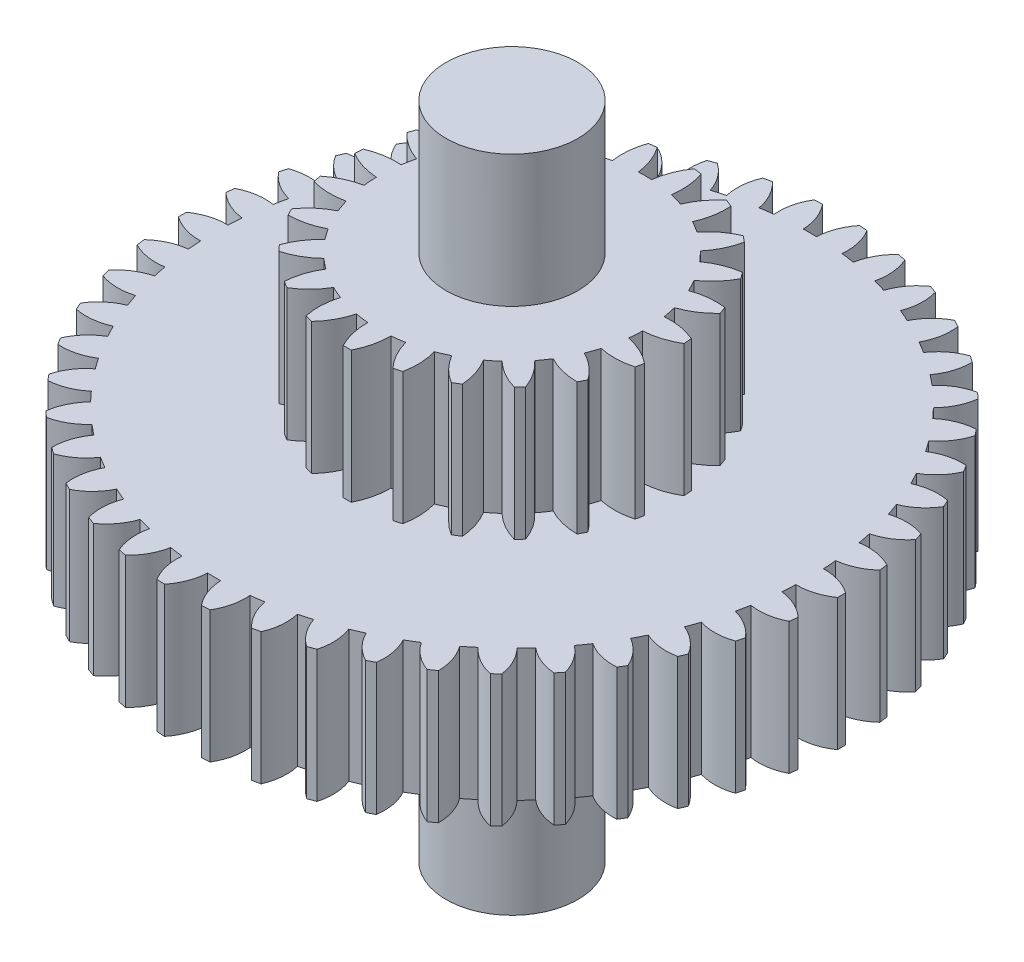
from build123d import *

# Parameters (mm, degrees)
BOSS_EXTRUDE1_DEPTH      = 1
BOSS_EXTRUDE2_DEPTH      = 2
BOSS_EXTRUDE2_DEPTH_BACK = 3
SKETCH2_R                = 0.5
BOSS_EXTRUDE3_DEPTH      = 1


with BuildPart() as part:
    # Sketch1 → Boss-Extrude1 (new body)
    with BuildSketch(Plane(origin=(0, 0, 0), x_dir=(1, 0, 0), z_dir=(0, 1, 0))):
        with BuildLine():
            ThreePointArc((-1.122849348, 2.23365381), (-1.150162594, 2.219713046), (-1.17730279, 2.20543831))
            ThreePointArc((-1.17730279, 2.20543831), (-1.174225974, 2.07727607), (-1.131251341, 1.956494417))
            ThreePointArc((-1.131251341, 1.956494417), (-1.174259727, 1.930987854), (-1.216693282, 1.904536022))
            ThreePointArc((-1.216693282, 1.904536022), (-1.3041624, 1.998259979), (-1.416540223, 2.059954804))
            ThreePointArc((-1.416540223, 2.059954804), (-1.441700805, 2.042424733), (-1.466644473, 2.024587363))
            ThreePointArc((-1.466644473, 2.024587363), (-1.446144892, 1.898037792), (-1.387124094, 1.784232818))
            ThreePointArc((-1.387124094, 1.784232818), (-1.426258754, 1.753107517), (-1.464695223, 1.721124023))
            ThreePointArc((-1.464695223, 1.721124023), (-1.564111726, 1.802064654), (-1.683843634, 1.847882739))
            ThreePointArc((-1.683843634, 1.847882739), (-1.706382858, 1.827089911), (-1.728665344, 1.806022184))
            ThreePointArc((-1.728665344, 1.806022184), (-1.691124866, 1.683442662), (-1.617157349, 1.578734337))
            ThreePointArc((-1.617157349, 1.578734337), (-1.651689279, 1.542570104), (-1.685412664, 1.505650741))
            ThreePointArc((-1.685412664, 1.505650741), (-1.79492461, 1.572300274), (-1.919780224, 1.601388114))
            ThreePointArc((-1.919780224, 1.601388114), (-1.939278227, 1.577719861), (-1.958484451, 1.553814228))
            ThreePointArc((-1.958484451, 1.553814228), (-1.904602384, 1.43748818), (-1.817066023, 1.343827023))
            ThreePointArc((-1.817066023, 1.343827023), (-1.846351958, 1.303297528), (-1.874734055, 1.262130034))
            ThreePointArc((-1.874734055, 1.262130034), (-1.992301445, 1.313246914), (-2.119954941, 1.325062658))
            ThreePointArc((-2.119954941, 1.325062658), (-2.136048511, 1.298959875), (-2.151820698, 1.272661654))
            ThreePointArc((-2.151820698, 1.272661654), (-2.082600763, 1.164756013), (-1.983126195, 1.083886754))
            ThreePointArc((-1.983126195, 1.083886754), (-2.006620594, 1.039746985), (-2.029132698, 0.995098232))
            ThreePointArc((-2.029132698, 0.995098232), (-2.152565474, 1.02973025), (-2.280638908, 1.024053793))
            ThreePointArc((-2.280638908, 1.024053793), (-2.293028254, 0.996002725), (-2.305072596, 0.967801801))
            ThreePointArc((-2.305072596, 0.967801801), (-2.22180423, 0.870326645), (-2.112244478, 0.803755726))
            ThreePointArc((-2.112244478, 0.803755726), (-2.129509684, 0.756827924), (-2.145732439, 0.709529634))
            ThreePointArc((-2.145732439, 0.709529634), (-2.272731281, 0.727031659), (-2.398838888, 0.703968742))
            ThreePointArc((-2.398838888, 0.703968742), (-2.407293218, 0.674491928), (-2.415385354, 0.644913631))
            ThreePointArc((-2.415385354, 0.644913631), (-2.319619689, 0.559684739), (-2.202015642, 0.508652249))
            ThreePointArc((-2.202015642, 0.508652249), (-2.212730038, 0.459810589), (-2.222361244, 0.41074384))
            ThreePointArc((-2.222361244, 0.41074384), (-2.350560404, 0.410789844), (-2.472353038, 0.370770087))
            ThreePointArc((-2.472353038, 0.370770087), (-2.476714865, 0.340416623), (-2.480704053, 0.310011941))
            ThreePointArc((-2.480704053, 0.310011941), (-2.374225021, 0.238616965), (-2.250767422, 0.204073543))
            ThreePointArc((-2.250767422, 0.204073543), (-2.254731418, 0.154227854), (-2.257591664, 0.104306666))
            ThreePointArc((-2.257591664, 0.104306666), (-2.384603034, 0.086895792), (-2.499811928, 0.030664685))
            ThreePointArc((-2.499811928, 0.030664685), (-2.5, 0), (-2.499811928, -0.030664685))
            ThreePointArc((-2.499811928, -0.030664685), (-2.384603034, -0.086895792), (-2.257591664, -0.104306666))
            ThreePointArc((-2.257591664, -0.104306666), (-2.254731418, -0.154227854), (-2.250767422, -0.204073543))
            ThreePointArc((-2.250767422, -0.204073543), (-2.374225021, -0.238616965), (-2.480704053, -0.310011941))
            ThreePointArc((-2.480704053, -0.310011941), (-2.476714865, -0.340416623), (-2.472353038, -0.370770087))
            ThreePointArc((-2.472353038, -0.370770087), (-2.350560404, -0.410789844), (-2.222361244, -0.41074384))
            ThreePointArc((-2.222361244, -0.41074384), (-2.212730038, -0.459810589), (-2.202015642, -0.508652249))
            ThreePointArc((-2.202015642, -0.508652249), (-2.319619689, -0.559684739), (-2.415385354, -0.644913631))
            ThreePointArc((-2.415385354, -0.644913631), (-2.407293218, -0.674491928), (-2.398838888, -0.703968742))
            ThreePointArc((-2.398838888, -0.703968742), (-2.272731281, -0.727031659), (-2.145732439, -0.709529634))
            ThreePointArc((-2.145732439, -0.709529634), (-2.129509684, -0.756827924), (-2.112244478, -0.803755726))
            ThreePointArc((-2.112244478, -0.803755726), (-2.22180423, -0.870326645), (-2.305072596, -0.967801801))
            ThreePointArc((-2.305072596, -0.967801801), (-2.293028254, -0.996002725), (-2.280638908, -1.024053793))
            ThreePointArc((-2.280638908, -1.024053793), (-2.152565474, -1.02973025), (-2.029132698, -0.995098232))
            ThreePointArc((-2.029132698, -0.995098232), (-2.006620594, -1.039746985), (-1.983126195, -1.083886754))
            ThreePointArc((-1.983126195, -1.083886754), (-2.082600763, -1.164756013), (-2.151820698, -1.272661654))
            ThreePointArc((-2.151820698, -1.272661654), (-2.136048511, -1.298959875), (-2.119954941, -1.325062658))
            ThreePointArc((-2.119954941, -1.325062658), (-1.992301445, -1.313246914), (-1.874734055, -1.262130034))
            ThreePointArc((-1.874734055, -1.262130034), (-1.846351958, -1.303297528), (-1.817066023, -1.343827023))
            ThreePointArc((-1.817066023, -1.343827023), (-1.904602384, -1.43748818), (-1.958484451, -1.553814228))
            ThreePointArc((-1.958484451, -1.553814228), (-1.939278227, -1.577719861), (-1.919780224, -1.601388114))
            ThreePointArc((-1.919780224, -1.601388114), (-1.79492461, -1.572300274), (-1.685412664, -1.505650741))
            ThreePointArc((-1.685412664, -1.505650741), (-1.651689279, -1.542570104), (-1.617157349, -1.578734337))
            ThreePointArc((-1.617157349, -1.578734337), (-1.691124866, -1.683442662), (-1.728665344, -1.806022184))
            ThreePointArc((-1.728665344, -1.806022184), (-1.706382858, -1.827089911), (-1.683843634, -1.847882739))
            ThreePointArc((-1.683843634, -1.847882739), (-1.564111726, -1.802064654), (-1.464695223, -1.721124023))
            ThreePointArc((-1.464695223, -1.721124023), (-1.426258754, -1.753107517), (-1.387124094, -1.784232818))
            ThreePointArc((-1.387124094, -1.784232818), (-1.446144892, -1.898037792), (-1.466644473, -2.024587363))
            ThreePointArc((-1.466644473, -2.024587363), (-1.441700805, -2.042424733), (-1.416540223, -2.059954804))
            ThreePointArc((-1.416540223, -2.059954804), (-1.3041624, -1.998259979), (-1.216693282, -1.904536022))
            ThreePointArc((-1.216693282, -1.904536022), (-1.174259727, -1.930987854), (-1.131251341, -1.956494417))
            ThreePointArc((-1.131251341, -1.956494417), (-1.174225974, -2.07727607), (-1.17730279, -2.20543831))
            ThreePointArc((-1.17730279, -2.20543831), (-1.150162594, -2.219713046), (-1.122849348, -2.23365381))
            ThreePointArc((-1.122849348, -2.23365381), (-1.019918995, -2.157231501), (-0.946026647, -2.052470118))
            ThreePointArc((-0.946026647, -2.052470118), (-0.900386463, -2.072897541), (-0.854305516, -2.092310227))
            ThreePointArc((-0.854305516, -2.092310227), (-0.880433448, -2.217818624), (-0.866030184, -2.345206115))
            ThreePointArc((-0.866030184, -2.345206115), (-0.83719903, -2.355652305), (-0.808241914, -2.365744071))
            ThreePointArc((-0.808241914, -2.365744071), (-0.71667643, -2.276017883), (-0.657737325, -2.162170579))
            ThreePointArc((-0.657737325, -2.162170579), (-0.609740703, -2.176193069), (-0.561445596, -2.189150256))
            ThreePointArc((-0.561445596, -2.189150256), (-0.570240113, -2.317047414), (-0.538625074, -2.441287167))
            ThreePointArc((-0.538625074, -2.441287167), (-0.508640033, -2.447710219), (-0.478578463, -2.453764996))
            ThreePointArc((-0.478578463, -2.453764996), (-0.400083539, -2.352406357), (-0.357195602, -2.231593893))
            ThreePointArc((-0.357195602, -2.231593893), (-0.307736627, -2.238950238), (-0.258127007, -2.245210558))
            ThreePointArc((-0.258127007, -2.245210558), (-0.249424284, -2.373113995), (-0.201186398, -2.491891658))
            ThreePointArc((-0.201186398, -2.491891658), (-0.170606033, -2.494171923), (-0.14, -2.496076922))
            ThreePointArc((-0.14, -2.496076922), (-0.076037848, -2.384973952), (-0.05, -2.259446835))
            ThreePointArc((-0.05, -2.259446835), (0, -2.26), (0.05, -2.259446835))
            ThreePointArc((0.05, -2.259446835), (0.076037848, -2.384973952), (0.14, -2.496076922))
            ThreePointArc((0.14, -2.496076922), (0.170606033, -2.494171923), (0.201186398, -2.491891658))
            ThreePointArc((0.201186398, -2.491891658), (0.249424284, -2.373113995), (0.258127007, -2.245210558))
            ThreePointArc((0.258127007, -2.245210558), (0.307736627, -2.238950238), (0.357195602, -2.231593893))
            ThreePointArc((0.357195602, -2.231593893), (0.400083539, -2.352406357), (0.478578463, -2.453764996))
            ThreePointArc((0.478578463, -2.453764996), (0.508640033, -2.447710219), (0.538625074, -2.441287167))
            ThreePointArc((0.538625074, -2.441287167), (0.570240113, -2.317047414), (0.561445596, -2.189150256))
            ThreePointArc((0.561445596, -2.189150256), (0.609740703, -2.176193069), (0.657737325, -2.162170579))
            ThreePointArc((0.657737325, -2.162170579), (0.71667643, -2.276017883), (0.808241914, -2.365744071))
            ThreePointArc((0.808241914, -2.365744071), (0.83719903, -2.355652305), (0.866030184, -2.345206115))
            ThreePointArc((0.866030184, -2.345206115), (0.880433448, -2.217818624), (0.854305516, -2.092310227))
            ThreePointArc((0.854305516, -2.092310227), (0.900386463, -2.072897541), (0.946026647, -2.052470118))
            ThreePointArc((0.946026647, -2.052470118), (1.019918995, -2.157231501), (1.122849348, -2.23365381))
            ThreePointArc((1.122849348, -2.23365381), (1.150162594, -2.219713046), (1.17730279, -2.20543831))
            ThreePointArc((1.17730279, -2.20543831), (1.174225974, -2.07727607), (1.131251341, -1.956494417))
            ThreePointArc((1.131251341, -1.956494417), (1.174259727, -1.930987854), (1.216693282, -1.904536022))
            ThreePointArc((1.216693282, -1.904536022), (1.3041624, -1.998259979), (1.416540223, -2.059954804))
            ThreePointArc((1.416540223, -2.059954804), (1.441700805, -2.042424733), (1.466644473, -2.024587363))
            ThreePointArc((1.466644473, -2.024587363), (1.446144892, -1.898037792), (1.387124094, -1.784232818))
            ThreePointArc((1.387124094, -1.784232818), (1.426258754, -1.753107517), (1.464695223, -1.721124023))
            ThreePointArc((1.464695223, -1.721124023), (1.564111726, -1.802064654), (1.683843634, -1.847882739))
            ThreePointArc((1.683843634, -1.847882739), (1.706382858, -1.827089911), (1.728665344, -1.806022184))
            ThreePointArc((1.728665344, -1.806022184), (1.691124866, -1.683442662), (1.617157349, -1.578734337))
            ThreePointArc((1.617157349, -1.578734337), (1.651689279, -1.542570104), (1.685412664, -1.505650741))
            ThreePointArc((1.685412664, -1.505650741), (1.79492461, -1.572300274), (1.919780224, -1.601388114))
            ThreePointArc((1.919780224, -1.601388114), (1.939278227, -1.577719861), (1.958484451, -1.553814228))
            ThreePointArc((1.958484451, -1.553814228), (1.904602384, -1.43748818), (1.817066023, -1.343827023))
            ThreePointArc((1.817066023, -1.343827023), (1.846351958, -1.303297528), (1.874734055, -1.262130034))
            ThreePointArc((1.874734055, -1.262130034), (1.992301445, -1.313246914), (2.119954941, -1.325062658))
            ThreePointArc((2.119954941, -1.325062658), (2.136048511, -1.298959875), (2.151820698, -1.272661654))
            ThreePointArc((2.151820698, -1.272661654), (2.082600763, -1.164756013), (1.983126195, -1.083886754))
            ThreePointArc((1.983126195, -1.083886754), (2.006620594, -1.039746985), (2.029132698, -0.995098232))
            ThreePointArc((2.029132698, -0.995098232), (2.152565474, -1.02973025), (2.280638908, -1.024053793))
            ThreePointArc((2.280638908, -1.024053793), (2.293028254, -0.996002725), (2.305072596, -0.967801801))
            ThreePointArc((2.305072596, -0.967801801), (2.22180423, -0.870326645), (2.112244478, -0.803755726))
            ThreePointArc((2.112244478, -0.803755726), (2.129509684, -0.756827924), (2.145732439, -0.709529634))
            ThreePointArc((2.145732439, -0.709529634), (2.272731281, -0.727031659), (2.398838888, -0.703968742))
            ThreePointArc((2.398838888, -0.703968742), (2.407293218, -0.674491928), (2.415385354, -0.644913631))
            ThreePointArc((2.415385354, -0.644913631), (2.319619689, -0.559684739), (2.202015642, -0.508652249))
            ThreePointArc((2.202015642, -0.508652249), (2.212730038, -0.459810589), (2.222361244, -0.41074384))
            ThreePointArc((2.222361244, -0.41074384), (2.350560404, -0.410789844), (2.472353038, -0.370770087))
            ThreePointArc((2.472353038, -0.370770087), (2.476714865, -0.340416623), (2.480704053, -0.310011941))
            ThreePointArc((2.480704053, -0.310011941), (2.374225021, -0.238616965), (2.250767422, -0.204073543))
            ThreePointArc((2.250767422, -0.204073543), (2.254731418, -0.154227854), (2.257591664, -0.104306666))
            ThreePointArc((2.257591664, -0.104306666), (2.384603034, -0.086895792), (2.499811928, -0.030664685))
            ThreePointArc((2.499811928, -0.030664685), (2.5, 0), (2.499811928, 0.030664685))
            ThreePointArc((2.499811928, 0.030664685), (2.384603034, 0.086895792), (2.257591664, 0.104306666))
            ThreePointArc((2.257591664, 0.104306666), (2.254731418, 0.154227854), (2.250767422, 0.204073543))
            ThreePointArc((2.250767422, 0.204073543), (2.374225021, 0.238616965), (2.480704053, 0.310011941))
            ThreePointArc((2.480704053, 0.310011941), (2.476714865, 0.340416623), (2.472353038, 0.370770087))
            ThreePointArc((2.472353038, 0.370770087), (2.350560404, 0.410789844), (2.222361244, 0.41074384))
            ThreePointArc((2.222361244, 0.41074384), (2.212730038, 0.459810589), (2.202015642, 0.508652249))
            ThreePointArc((2.202015642, 0.508652249), (2.319619689, 0.559684739), (2.415385354, 0.644913631))
            ThreePointArc((2.415385354, 0.644913631), (2.407293218, 0.674491928), (2.398838888, 0.703968742))
            ThreePointArc((2.398838888, 0.703968742), (2.272731281, 0.727031659), (2.145732439, 0.709529634))
            ThreePointArc((2.145732439, 0.709529634), (2.129509684, 0.756827924), (2.112244478, 0.803755726))
            ThreePointArc((2.112244478, 0.803755726), (2.22180423, 0.870326645), (2.305072596, 0.967801801))
            ThreePointArc((2.305072596, 0.967801801), (2.293028254, 0.996002725), (2.280638908, 1.024053793))
            ThreePointArc((2.280638908, 1.024053793), (2.152565474, 1.02973025), (2.029132698, 0.995098232))
            ThreePointArc((2.029132698, 0.995098232), (2.006620594, 1.039746985), (1.983126195, 1.083886754))
            ThreePointArc((1.983126195, 1.083886754), (2.082600763, 1.164756013), (2.151820698, 1.272661654))
            ThreePointArc((2.151820698, 1.272661654), (2.136048511, 1.298959875), (2.119954941, 1.325062658))
            ThreePointArc((2.119954941, 1.325062658), (1.992301445, 1.313246914), (1.874734055, 1.262130034))
            ThreePointArc((1.874734055, 1.262130034), (1.846351958, 1.303297528), (1.817066023, 1.343827023))
            ThreePointArc((1.817066023, 1.343827023), (1.904602384, 1.43748818), (1.958484451, 1.553814228))
            ThreePointArc((1.958484451, 1.553814228), (1.939278227, 1.577719861), (1.919780224, 1.601388114))
            ThreePointArc((1.919780224, 1.601388114), (1.79492461, 1.572300274), (1.685412664, 1.505650741))
            ThreePointArc((1.685412664, 1.505650741), (1.651689279, 1.542570104), (1.617157349, 1.578734337))
            ThreePointArc((1.617157349, 1.578734337), (1.691124866, 1.683442662), (1.728665344, 1.806022184))
            ThreePointArc((1.728665344, 1.806022184), (1.706382858, 1.827089911), (1.683843634, 1.847882739))
            ThreePointArc((1.683843634, 1.847882739), (1.564111726, 1.802064654), (1.464695223, 1.721124023))
            ThreePointArc((1.464695223, 1.721124023), (1.426258754, 1.753107517), (1.387124094, 1.784232818))
            ThreePointArc((1.387124094, 1.784232818), (1.446144892, 1.898037792), (1.466644473, 2.024587363))
            ThreePointArc((1.466644473, 2.024587363), (1.441700805, 2.042424733), (1.416540223, 2.059954804))
            ThreePointArc((1.416540223, 2.059954804), (1.3041624, 1.998259979), (1.216693282, 1.904536022))
            ThreePointArc((1.216693282, 1.904536022), (1.174259727, 1.930987854), (1.131251341, 1.956494417))
            ThreePointArc((1.131251341, 1.956494417), (1.174225974, 2.07727607), (1.17730279, 2.20543831))
            ThreePointArc((1.17730279, 2.20543831), (1.150162594, 2.219713046), (1.122849348, 2.23365381))
            ThreePointArc((1.122849348, 2.23365381), (1.019918995, 2.157231501), (0.946026647, 2.052470118))
            ThreePointArc((0.946026647, 2.052470118), (0.900386463, 2.072897541), (0.854305516, 2.092310227))
            ThreePointArc((0.854305516, 2.092310227), (0.880433448, 2.217818624), (0.866030184, 2.345206115))
            ThreePointArc((0.866030184, 2.345206115), (0.83719903, 2.355652305), (0.808241914, 2.365744071))
            ThreePointArc((0.808241914, 2.365744071), (0.71667643, 2.276017883), (0.657737325, 2.162170579))
            ThreePointArc((0.657737325, 2.162170579), (0.609740703, 2.176193069), (0.561445596, 2.189150256))
            ThreePointArc((0.561445596, 2.189150256), (0.570240113, 2.317047414), (0.538625074, 2.441287167))
            ThreePointArc((0.538625074, 2.441287167), (0.508640033, 2.447710219), (0.478578463, 2.453764996))
            ThreePointArc((0.478578463, 2.453764996), (0.400083539, 2.352406357), (0.357195602, 2.231593893))
            ThreePointArc((0.357195602, 2.231593893), (0.307736627, 2.238950238), (0.258127007, 2.245210558))
            ThreePointArc((0.258127007, 2.245210558), (0.249424284, 2.373113995), (0.201186398, 2.491891658))
            ThreePointArc((0.201186398, 2.491891658), (0.170606033, 2.494171923), (0.14, 2.496076922))
            ThreePointArc((0.14, 2.496076922), (0.076037848, 2.384973952), (0.05, 2.259446835))
            ThreePointArc((0.05, 2.259446835), (0, 2.26), (-0.05, 2.259446835))
            ThreePointArc((-0.05, 2.259446835), (-0.076037848, 2.384973952), (-0.14, 2.496076922))
            ThreePointArc((-0.14, 2.496076922), (-0.170606033, 2.494171923), (-0.201186398, 2.491891658))
            ThreePointArc((-0.201186398, 2.491891658), (-0.249424284, 2.373113995), (-0.258127007, 2.245210558))
            ThreePointArc((-0.258127007, 2.245210558), (-0.307736627, 2.238950238), (-0.357195602, 2.231593893))
            ThreePointArc((-0.357195602, 2.231593893), (-0.400083539, 2.352406357), (-0.478578463, 2.453764996))
            ThreePointArc((-0.478578463, 2.453764996), (-0.508640033, 2.447710219), (-0.538625074, 2.441287167))
            ThreePointArc((-0.538625074, 2.441287167), (-0.570240113, 2.317047414), (-0.561445596, 2.189150256))
            ThreePointArc((-0.561445596, 2.189150256), (-0.609740703, 2.176193069), (-0.657737325, 2.162170579))
            ThreePointArc((-0.657737325, 2.162170579), (-0.71667643, 2.276017883), (-0.808241914, 2.365744071))
            ThreePointArc((-0.808241914, 2.365744071), (-0.83719903, 2.355652305), (-0.866030184, 2.345206115))
            ThreePointArc((-0.866030184, 2.345206115), (-0.880433448, 2.217818624), (-0.854305516, 2.092310227))
            ThreePointArc((-0.854305516, 2.092310227), (-0.900386463, 2.072897541), (-0.946026647, 2.052470118))
            ThreePointArc((-0.946026647, 2.052470118), (-1.019918995, 2.157231501), (-1.122849348, 2.23365381))
        make_face()
    extrude(amount=BOSS_EXTRUDE1_DEPTH)

    # Sketch2 → Boss-Extrude2 (add, two sides: drawn at the far end of the back side and taken through both)
    with BuildSketch(Plane.XZ.offset(-BOSS_EXTRUDE2_DEPTH_BACK)):
        with Locations(Location((0, 0, 0), (0, 0, 270))):
            Circle(SKETCH2_R)
    extrude(amount=BOSS_EXTRUDE2_DEPTH + BOSS_EXTRUDE2_DEPTH_BACK)

    # Sketch3 → Boss-Extrude3 (add)
    with BuildSketch(Plane(origin=(0, 1, 0), x_dir=(1, 0, 0), z_dir=(0, 1, 0))):
        with BuildLine():
            ThreePointArc((-0.765012261, 0.988562715), (-0.78885993, 0.969639113), (-0.812239679, 0.95014036))
            ThreePointArc((-0.812239679, 0.95014036), (-0.771519926, 0.830895064), (-0.703111612, 0.725075211))
            ThreePointArc((-0.703111612, 0.725075211), (-0.738144324, 0.689378675), (-0.771366926, 0.651991614))
            ThreePointArc((-0.771366926, 0.651991614), (-0.881608438, 0.71301905), (-1.003354559, 0.74550629))
            ThreePointArc((-1.003354559, 0.74550629), (-1.021212366, 0.720850403), (-1.03846443, 0.695766935))
            ThreePointArc((-1.03846443, 0.695766935), (-0.96708268, 0.591929637), (-0.872661277, 0.508490212))
            ThreePointArc((-0.872661277, 0.508490212), (-0.896764071, 0.464665688), (-0.918667781, 0.41970169))
            ThreePointArc((-0.918667781, 0.41970169), (-1.041286243, 0.44872326), (-1.16728264, 0.447159074))
            ThreePointArc((-1.16728264, 0.447159074), (-1.177826153, 0.418599515), (-1.187671024, 0.38979166))
            ThreePointArc((-1.187671024, 0.38979166), (-1.090921335, 0.309063496), (-0.977489647, 0.254192821))
            ThreePointArc((-0.977489647, 0.254192821), (-0.988874929, 0.205490573), (-0.997835248, 0.156284412))
            ThreePointArc((-0.997835248, 0.156284412), (-1.123736611, 0.151147718), (-1.244638708, 0.115648115))
            ThreePointArc((-1.244638708, 0.115648115), (-1.247085961, 0.085303017), (-1.248793492, 0.05490732))
            ThreePointArc((-1.248793492, 0.05490732), (-1.133851346, 0.003275529), (-1.009822082, -0.018956889))
            ThreePointArc((-1.009822082, -0.018956889), (-1.007645457, -0.068924837), (-1.00299784, -0.118723766))
            ThreePointArc((-1.00299784, -0.118723766), (-1.122844575, -0.157637759), (-1.229685616, -0.224439935))
            ThreePointArc((-1.229685616, -0.224439935), (-1.22385511, -0.254320016), (-1.21729866, -0.284049244))
            ThreePointArc((-1.21729866, -0.284049244), (-1.092688789, -0.302755369), (-0.967260632, -0.290700653))
            ThreePointArc((-0.967260632, -0.290700653), (-0.951683531, -0.338228408), (-0.933772671, -0.384926745))
            ThreePointArc((-0.933772671, -0.384926745), (-1.038676294, -0.454731964), (-1.123532368, -0.547882303))
            ThreePointArc((-1.123532368, -0.547882303), (-1.109856523, -0.575081297), (-1.095522354, -0.601939176))
            ThreePointArc((-1.095522354, -0.601939176), (-0.970486504, -0.586332286), (-0.852961886, -0.54088448))
            ThreePointArc((-0.852961886, -0.54088448), (-0.825139592, -0.582447125), (-0.795293854, -0.622581469))
            ThreePointArc((-0.795293854, -0.622581469), (-0.877474144, -0.71810078), (-0.934051864, -0.830690746))
            ThreePointArc((-0.934051864, -0.830690746), (-0.913544955, -0.853191429), (-0.892496167, -0.875186032))
            ThreePointArc((-0.892496167, -0.875186032), (-0.776307675, -0.826423619), (-0.67540286, -0.750953379))
            ThreePointArc((-0.67540286, -0.750953379), (-0.637398824, -0.783468404), (-0.597831731, -0.814062173))
            ThreePointArc((-0.597831731, -0.814062173), (-0.651193751, -0.928211346), (-0.675297006, -1.051890657))
            ThreePointArc((-0.675297006, -1.051890657), (-0.649479938, -1.068024256), (-0.623277623, -1.083524344))
            ThreePointArc((-0.623277623, -1.083524344), (-0.524553656, -1.005222894), (-0.447752293, -0.905327501))
            ThreePointArc((-0.447752293, -0.905327501), (-0.402385101, -0.926383415), (-0.356031163, -0.94516761))
            ThreePointArc((-0.356031163, -0.94516761), (-0.376617296, -1.069480723), (-0.366458458, -1.19507665))
            ThreePointArc((-0.366458458, -1.19507665), (-0.337245964, -1.203646609), (-0.307833428, -1.211502613))
            ThreePointArc((-0.307833428, -1.211502613), (-0.233895893, -1.109469385), (-0.186893986, -0.992557624))
            ThreePointArc((-0.186893986, -0.992557624), (-0.137528316, -1.000592805), (-0.087825392, -1.006174289))
            ThreePointArc((-0.087825392, -1.006174289), (-0.074108859, -1.131431607), (-0.030441363, -1.249629274))
            ThreePointArc((-0.030441363, -1.249629274), (0, -1.25), (0.030441363, -1.249629274))
            ThreePointArc((0.030441363, -1.249629274), (0.074108859, -1.131431607), (0.087825392, -1.006174289))
            ThreePointArc((0.087825392, -1.006174289), (0.137528316, -1.000592805), (0.186893986, -0.992557624))
            ThreePointArc((0.186893986, -0.992557624), (0.233895893, -1.109469385), (0.307833428, -1.211502613))
            ThreePointArc((0.307833428, -1.211502613), (0.337245964, -1.203646609), (0.366458458, -1.19507665))
            ThreePointArc((0.366458458, -1.19507665), (0.376617296, -1.069480723), (0.356031163, -0.94516761))
            ThreePointArc((0.356031163, -0.94516761), (0.402385101, -0.926383415), (0.447752293, -0.905327501))
            ThreePointArc((0.447752293, -0.905327501), (0.524553656, -1.005222894), (0.623277623, -1.083524344))
            ThreePointArc((0.623277623, -1.083524344), (0.649479938, -1.068024256), (0.675297006, -1.051890657))
            ThreePointArc((0.675297006, -1.051890657), (0.651193751, -0.928211346), (0.597831731, -0.814062173))
            ThreePointArc((0.597831731, -0.814062173), (0.637398824, -0.783468404), (0.67540286, -0.750953379))
            ThreePointArc((0.67540286, -0.750953379), (0.776307675, -0.826423619), (0.892496167, -0.875186032))
            ThreePointArc((0.892496167, -0.875186032), (0.913544955, -0.853191429), (0.934051864, -0.830690746))
            ThreePointArc((0.934051864, -0.830690746), (0.877474144, -0.71810078), (0.795293854, -0.622581469))
            ThreePointArc((0.795293854, -0.622581469), (0.825139592, -0.582447125), (0.852961886, -0.54088448))
            ThreePointArc((0.852961886, -0.54088448), (0.970486504, -0.586332286), (1.095522354, -0.601939176))
            ThreePointArc((1.095522354, -0.601939176), (1.109856523, -0.575081297), (1.123532368, -0.547882303))
            ThreePointArc((1.123532368, -0.547882303), (1.038676294, -0.454731964), (0.933772671, -0.384926745))
            ThreePointArc((0.933772671, -0.384926745), (0.951683531, -0.338228408), (0.967260632, -0.290700653))
            ThreePointArc((0.967260632, -0.290700653), (1.092688789, -0.302755369), (1.21729866, -0.284049244))
            ThreePointArc((1.21729866, -0.284049244), (1.22385511, -0.254320016), (1.229685616, -0.224439935))
            ThreePointArc((1.229685616, -0.224439935), (1.122844575, -0.157637759), (1.00299784, -0.118723766))
            ThreePointArc((1.00299784, -0.118723766), (1.007645457, -0.068924837), (1.009822082, -0.018956889))
            ThreePointArc((1.009822082, -0.018956889), (1.133851346, 0.003275529), (1.248793492, 0.05490732))
            ThreePointArc((1.248793492, 0.05490732), (1.247085961, 0.085303017), (1.244638708, 0.115648115))
            ThreePointArc((1.244638708, 0.115648115), (1.123736611, 0.151147718), (0.997835248, 0.156284412))
            ThreePointArc((0.997835248, 0.156284412), (0.988874929, 0.205490573), (0.977489647, 0.254192821))
            ThreePointArc((0.977489647, 0.254192821), (1.090921335, 0.309063496), (1.187671024, 0.38979166))
            ThreePointArc((1.187671024, 0.38979166), (1.177826153, 0.418599515), (1.16728264, 0.447159074))
            ThreePointArc((1.16728264, 0.447159074), (1.041286243, 0.44872326), (0.918667781, 0.41970169))
            ThreePointArc((0.918667781, 0.41970169), (0.896764071, 0.464665688), (0.872661277, 0.508490212))
            ThreePointArc((0.872661277, 0.508490212), (0.96708268, 0.591929637), (1.03846443, 0.695766935))
            ThreePointArc((1.03846443, 0.695766935), (1.021212366, 0.720850403), (1.003354559, 0.74550629))
            ThreePointArc((1.003354559, 0.74550629), (0.881608438, 0.71301905), (0.771366926, 0.651991614))
            ThreePointArc((0.771366926, 0.651991614), (0.738144324, 0.689378675), (0.703111612, 0.725075211))
            ThreePointArc((0.703111612, 0.725075211), (0.771519926, 0.830895064), (0.812239679, 0.95014036))
            ThreePointArc((0.812239679, 0.95014036), (0.78885993, 0.969639113), (0.765012261, 0.988562715))
            ThreePointArc((0.765012261, 0.988562715), (0.656545768, 0.92443348), (0.566857316, 0.835926303))
            ThreePointArc((0.566857316, 0.835926303), (0.52477979, 0.862963599), (0.481415375, 0.887884698))
            ThreePointArc((0.481415375, 0.887884698), (0.518737068, 1.008236806), (0.525774827, 1.134046221))
            ThreePointArc((0.525774827, 1.134046221), (0.498001362, 1.146514127), (0.469932502, 1.158301966))
            ThreePointArc((0.469932502, 1.158301966), (0.382790102, 1.067286907), (0.320306492, 0.957864161))
            ThreePointArc((0.320306492, 0.957864161), (0.272494739, 0.97254646), (0.224014763, 0.984843838))
            ThreePointArc((0.224014763, 0.984843838), (0.227481856, 1.110802237), (0.200315662, 1.233845061))
            ThreePointArc((0.200315662, 1.233845061), (0.170208311, 1.238357433), (0.14, 1.242135258))
            ThreePointArc((0.14, 1.242135258), (0.080644645, 1.130984547), (0.05, 1.008761617))
            ThreePointArc((0.05, 1.008761617), (0, 1.01), (-0.05, 1.008761617))
            ThreePointArc((-0.05, 1.008761617), (-0.080644645, 1.130984547), (-0.14, 1.242135258))
            ThreePointArc((-0.14, 1.242135258), (-0.170208311, 1.238357433), (-0.200315662, 1.233845061))
            ThreePointArc((-0.200315662, 1.233845061), (-0.227481856, 1.110802237), (-0.224014763, 0.984843838))
            ThreePointArc((-0.224014763, 0.984843838), (-0.272494739, 0.97254646), (-0.320306492, 0.957864161))
            ThreePointArc((-0.320306492, 0.957864161), (-0.382790102, 1.067286907), (-0.469932502, 1.158301966))
            ThreePointArc((-0.469932502, 1.158301966), (-0.498001362, 1.146514127), (-0.525774827, 1.134046221))
            ThreePointArc((-0.525774827, 1.134046221), (-0.518737068, 1.008236806), (-0.481415375, 0.887884698))
            ThreePointArc((-0.481415375, 0.887884698), (-0.52477979, 0.862963599), (-0.566857316, 0.835926303))
            ThreePointArc((-0.566857316, 0.835926303), (-0.656545768, 0.92443348), (-0.765012261, 0.988562715))
        make_face()
    extrude(amount=BOSS_EXTRUDE3_DEPTH)


solid = part.part
